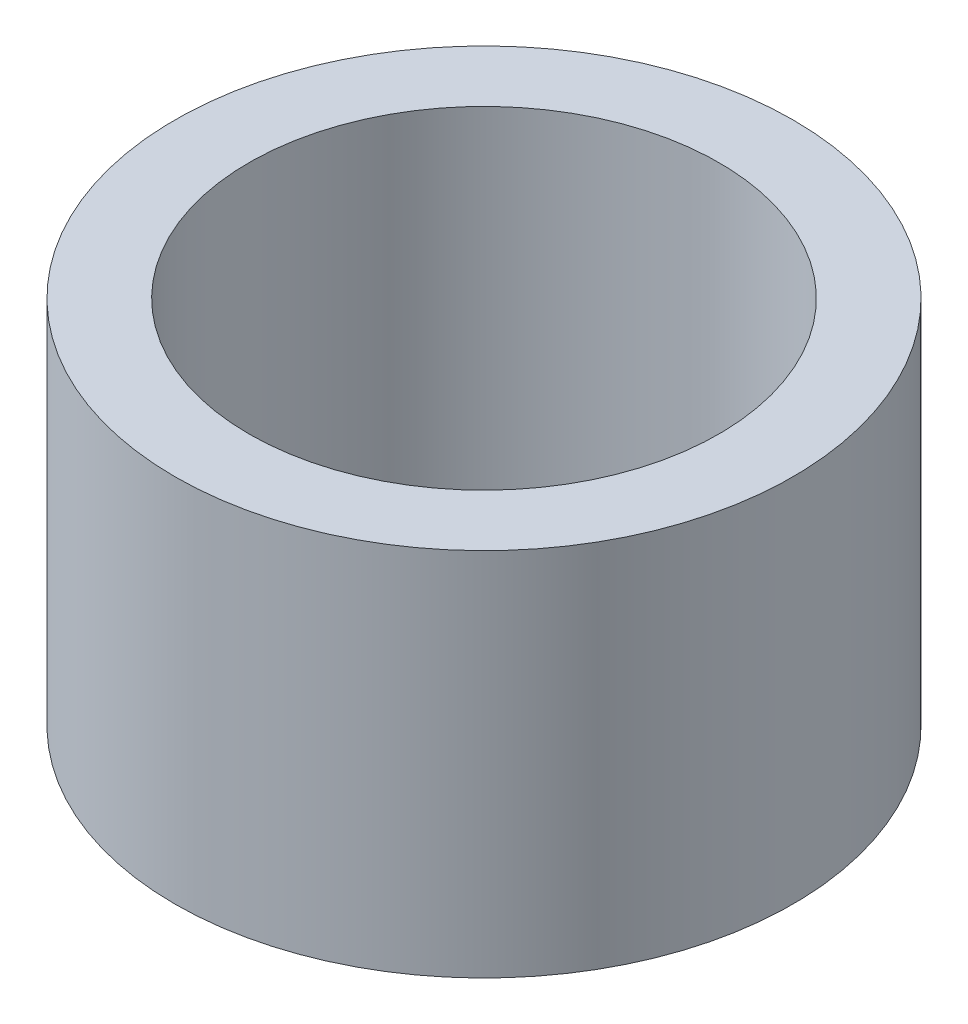
from build123d import *

# Parameters (mm, degrees)
SKETCH1_R           = 2.1209
SKETCH1_R_2         = 1.6129
BOSS_EXTRUDE1_DEPTH = 2.54


with BuildPart() as part:
    # Sketch1 → Boss-Extrude1 (new body)
    with BuildSketch(Plane(origin=(0, 0, 0), x_dir=(1, 0, 0), z_dir=(0, 1, 0))):
        with Locations(Location((0, 0, 0), (0, 0, 270))):
            Circle(SKETCH1_R)
        with Locations(Location((0, 0, 0), (0, 0, 270))):
            Circle(SKETCH1_R_2, mode=Mode.SUBTRACT)
    extrude(amount=BOSS_EXTRUDE1_DEPTH)


solid = part.part
